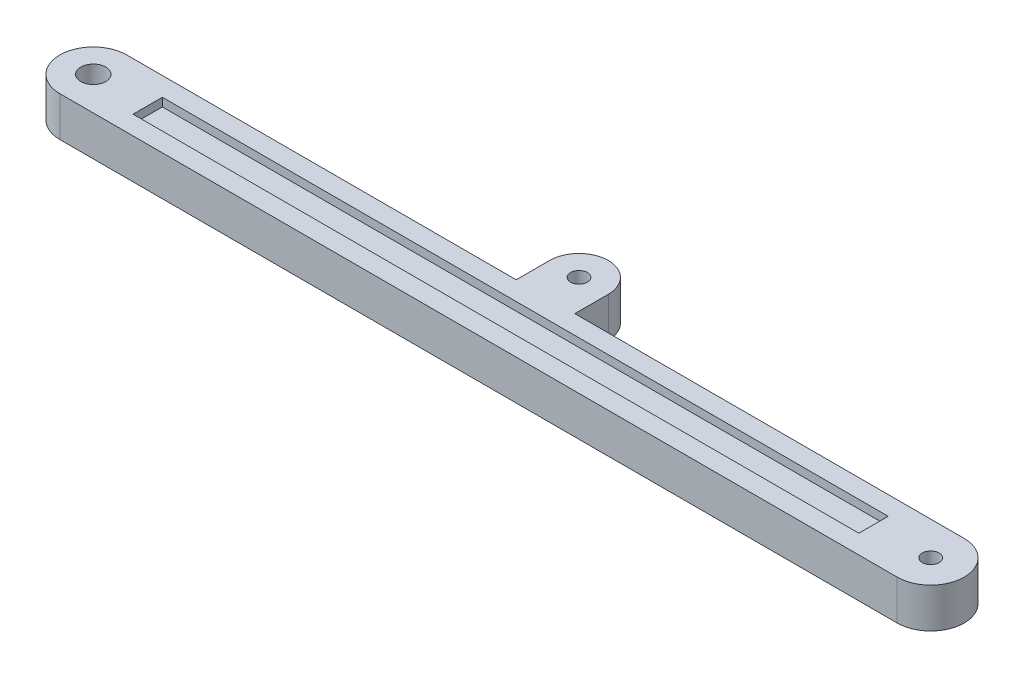
from build123d import *

# Parameters (mm, degrees)
SKETCH1_R           = 2
SKETCH1_R_2         = 3
BOSS_EXTRUDE1_DEPTH = 9.5
SKETCH2_W           = 173.341634435
SKETCH2_H           = 7
CUT_EXTRUDE1_DEPTH  = 2


with BuildPart() as part:
    # Sketch1 → Boss-Extrude1 (new body)
    with BuildSketch(Plane(origin=(0, 0, 0), x_dir=(1, 0, 0), z_dir=(0, 1, 0))):
        with BuildLine():
            Line((97, 16), (97, 24))
            ThreePointArc((97, 24), (90, 31), (83, 24))
            Line((83, 24), (83, 16))
            Line((83, 16), (-10, 16))
            ThreePointArc((-10, 16), (-18, 8), (-10, 0))
            Line((-10, 0), (190, 0))
            ThreePointArc((190, 0), (198, 8), (190, 16))
            Line((190, 16), (97, 16))
        make_face()
        with Locations(Location((90, 24, 0), (0, 0, 270))):
            Circle(SKETCH1_R, mode=Mode.SUBTRACT)
        with Locations(Location((-10, 8, 0), (0, 0, 270))):
            Circle(SKETCH1_R_2, mode=Mode.SUBTRACT)
        with Locations(Location((190, 8, 0), (0, 0, 270))):
            Circle(SKETCH1_R, mode=Mode.SUBTRACT)
    extrude(amount=BOSS_EXTRUDE1_DEPTH)

    # Sketch2 → Cut-Extrude1 (cut)
    with BuildSketch(Plane(origin=(0, 9.5, 0), x_dir=(1, 0, 0), z_dir=(0, 1, 0))):
        with Locations((89.670817218, 8)):
            Rectangle(SKETCH2_W, SKETCH2_H)
    extrude(amount=-CUT_EXTRUDE1_DEPTH, mode=Mode.SUBTRACT)


solid = part.part
